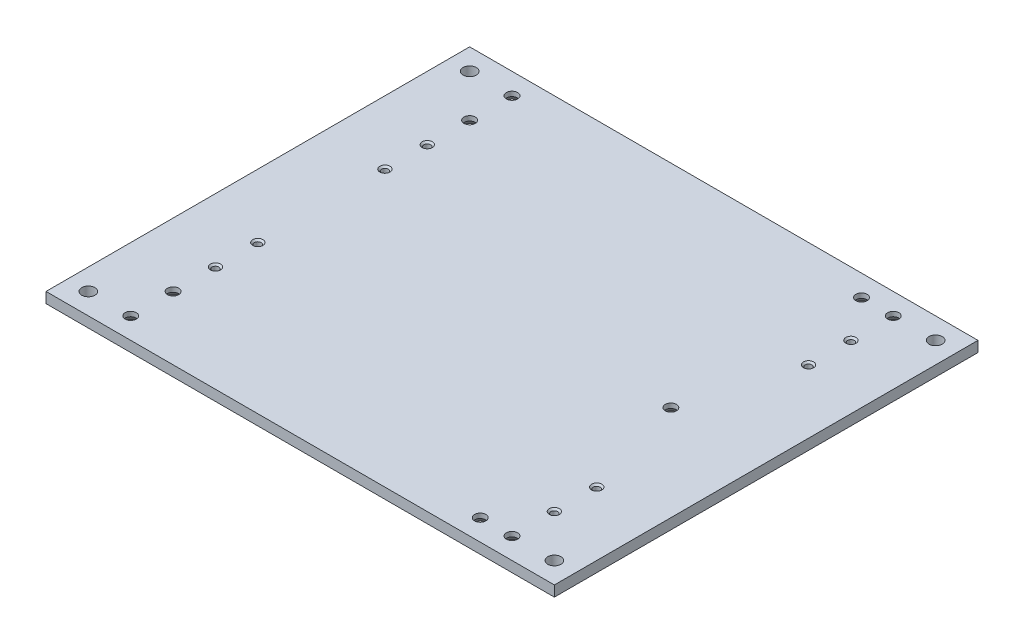
from build123d import *

# Parameters (mm, degrees)
SKETCH2_W                                     = 304.8
SKETCH2_H                                     = 254
BOSS_EXTRUDE1_DEPTH                           = 6.35
SKETCH3_R                                     = 3.96875
CUT_EXTRUDE1_DEPTH                            = 199.481945023
CSK_FOR_1_4_FLAT_HEAD_MACHINE_SCREW1_AT_COUNT = 2
CSK_FOR_1_4_FLAT_HEAD_MACHINE_SCREW1_AT_PITCH = 228.6
CSK_FOR_1_4_FLAT_HEAD_MACHINE_SCREW1_2_COUNT  = 2
CSK_FOR_1_4_FLAT_HEAD_MACHINE_SCREW1_2_PITCH  = 323.289220358
CSK_FOR_1_4_FLAT_HEAD_MACHINE_SCREW1_3_COUNT  = 2
CSK_FOR_1_4_FLAT_HEAD_MACHINE_SCREW1_3_PITCH  = 228.6
CSK_FOR_1_4_FLAT_HEAD_MACHINE_SCREW1_4_COUNT  = 2
CSK_FOR_1_4_FLAT_HEAD_MACHINE_SCREW1_4_PITCH  = 209.55
CSK_FOR_1_4_FLAT_HEAD_MACHINE_SCREW1_5_COUNT  = 2
CSK_FOR_1_4_FLAT_HEAD_MACHINE_SCREW1_5_PITCH  = 238.695815841
CSK_FOR_1_4_FLAT_HEAD_MACHINE_SCREW1_6_COUNT  = 2
CSK_FOR_1_4_FLAT_HEAD_MACHINE_SCREW1_6_PITCH  = 310.111532356
CSK_FOR_1_4_FLAT_HEAD_MACHINE_SCREW1_7_COUNT  = 2
CSK_FOR_1_4_FLAT_HEAD_MACHINE_SCREW1_7_PITCH  = 25.4
CSK_FOR_1_4_FLAT_HEAD_MACHINE_SCREW1_8_COUNT  = 2
CSK_FOR_1_4_FLAT_HEAD_MACHINE_SCREW1_8_PITCH  = 203.2
F_10_32_TAPPED_HOLE1_D                        = 4.0386
F_10_32_TAPPED_HOLE1_CSINK_D                  = 6.096
F_10_32_TAPPED_HOLE1_CSINK_ANGLE              = 90


with BuildPart() as part:
    # Sketch2 → Boss-Extrude1 (new body)
    with BuildSketch(Plane(origin=(0, 0, 0), x_dir=(1, 0, 0), z_dir=(0, 1, 0))):
        Rectangle(SKETCH2_W, SKETCH2_H)
    extrude(amount=BOSS_EXTRUDE1_DEPTH)

    # Sketch3 → Cut-Extrude1 (cut, through all)
    with BuildSketch(Plane(origin=(0, 6.35, 0), x_dir=(1, 0, 0), z_dir=(0, 1, 0))):
        with Locations(Location((139.7, 114.3, 0), (0, 0, 270))):
            Circle(SKETCH3_R)
        with Locations(Location((139.7, -114.3, 0), (0, 0, 90))):
            Circle(SKETCH3_R)
        with Locations(Location((-139.7, 114.3, 0), (0, 0, 90))):
            Circle(SKETCH3_R)
        with Locations(Location((-139.7, -114.3, 0), (0, 0, 270))):
            Circle(SKETCH3_R)
    extrude(amount=-CUT_EXTRUDE1_DEPTH, mode=Mode.SUBTRACT)

    # Sketch5 → CSK for 1/4 Flat Head Machine Screw1 (revolve, cut)
    with BuildSketch(Plane(origin=(-114.3, 0, -114.3), x_dir=(0, 0, -1), z_dir=(1, 0, 0))):
        Polygon((0, 0), (0, 6.35), (3.3782, 6.35), (3.3782, 3.520932584), (6.4389, 0), align=None)
    csk_for_1_4_flat_head_machine_screw1 = revolve(axis=Axis((-114.3, -6.35, -114.3), (0, 1, 0)), mode=Mode.SUBTRACT)

    # CSK for 1/4 Flat Head Machine Screw1 at: CSK for 1/4 Flat Head Machine Screw1 ×2
    with Locations(*[(0, 0, i * CSK_FOR_1_4_FLAT_HEAD_MACHINE_SCREW1_AT_PITCH) for i in range(1, CSK_FOR_1_4_FLAT_HEAD_MACHINE_SCREW1_AT_COUNT)]):
        add(csk_for_1_4_flat_head_machine_screw1, mode=Mode.SUBTRACT)

    # CSK for 1_4 Flat Head Machine Screw1 2: CSK for 1/4 Flat Head Machine Screw1 ×2
    with Locations(*[Vector(0.7071067811865474, 0, 0.7071067811865477) * (i * CSK_FOR_1_4_FLAT_HEAD_MACHINE_SCREW1_2_PITCH) for i in range(1, CSK_FOR_1_4_FLAT_HEAD_MACHINE_SCREW1_2_COUNT)]):
        add(csk_for_1_4_flat_head_machine_screw1, mode=Mode.SUBTRACT)

    # CSK for 1_4 Flat Head Machine Screw1 3: CSK for 1/4 Flat Head Machine Screw1 ×2
    with Locations(*[(i * CSK_FOR_1_4_FLAT_HEAD_MACHINE_SCREW1_3_PITCH, 0, 0) for i in range(1, CSK_FOR_1_4_FLAT_HEAD_MACHINE_SCREW1_3_COUNT)]):
        add(csk_for_1_4_flat_head_machine_screw1, mode=Mode.SUBTRACT)

    # CSK for 1_4 Flat Head Machine Screw1 4: CSK for 1/4 Flat Head Machine Screw1 ×2
    with Locations(*[(i * CSK_FOR_1_4_FLAT_HEAD_MACHINE_SCREW1_4_PITCH, 0, 0) for i in range(1, CSK_FOR_1_4_FLAT_HEAD_MACHINE_SCREW1_4_COUNT)]):
        add(csk_for_1_4_flat_head_machine_screw1, mode=Mode.SUBTRACT)

    # CSK for 1_4 Flat Head Machine Screw1 5: CSK for 1/4 Flat Head Machine Screw1 ×2
    with Locations(*[Vector(0.8778955729143844, 0, 0.47885213068057336) * (i * CSK_FOR_1_4_FLAT_HEAD_MACHINE_SCREW1_5_PITCH) for i in range(1, CSK_FOR_1_4_FLAT_HEAD_MACHINE_SCREW1_5_COUNT)]):
        add(csk_for_1_4_flat_head_machine_screw1, mode=Mode.SUBTRACT)

    # CSK for 1_4 Flat Head Machine Screw1 6: CSK for 1/4 Flat Head Machine Screw1 ×2
    with Locations(*[Vector(0.6757246285173463, 0, 0.7371541402007415) * (i * CSK_FOR_1_4_FLAT_HEAD_MACHINE_SCREW1_6_PITCH) for i in range(1, CSK_FOR_1_4_FLAT_HEAD_MACHINE_SCREW1_6_COUNT)]):
        add(csk_for_1_4_flat_head_machine_screw1, mode=Mode.SUBTRACT)

    # CSK for 1_4 Flat Head Machine Screw1 7: CSK for 1/4 Flat Head Machine Screw1 ×2
    with Locations(*[(0, 0, i * CSK_FOR_1_4_FLAT_HEAD_MACHINE_SCREW1_7_PITCH) for i in range(1, CSK_FOR_1_4_FLAT_HEAD_MACHINE_SCREW1_7_COUNT)]):
        add(csk_for_1_4_flat_head_machine_screw1, mode=Mode.SUBTRACT)

    # CSK for 1_4 Flat Head Machine Screw1 8: CSK for 1/4 Flat Head Machine Screw1 ×2
    with Locations(*[(0, 0, i * CSK_FOR_1_4_FLAT_HEAD_MACHINE_SCREW1_8_PITCH) for i in range(1, CSK_FOR_1_4_FLAT_HEAD_MACHINE_SCREW1_8_COUNT)]):
        add(csk_for_1_4_flat_head_machine_screw1, mode=Mode.SUBTRACT)

    # #10-32 Tapped Hole1 (through all)
    with Locations(Plane(origin=(0, 6.35, 0), x_dir=(1, 0, 0), z_dir=(0, 1, 0))):
        with Locations((114.3, -88.9), (114.3, -63.5), (114.3, 63.5), (114.3, 88.9), (-114.3, 63.5), (-114.3, 38.1), (-114.3, -63.5), (-114.3, -38.1)):
            CounterSinkHole(F_10_32_TAPPED_HOLE1_D / 2, F_10_32_TAPPED_HOLE1_CSINK_D / 2, counter_sink_angle=F_10_32_TAPPED_HOLE1_CSINK_ANGLE)


solid = part.part
